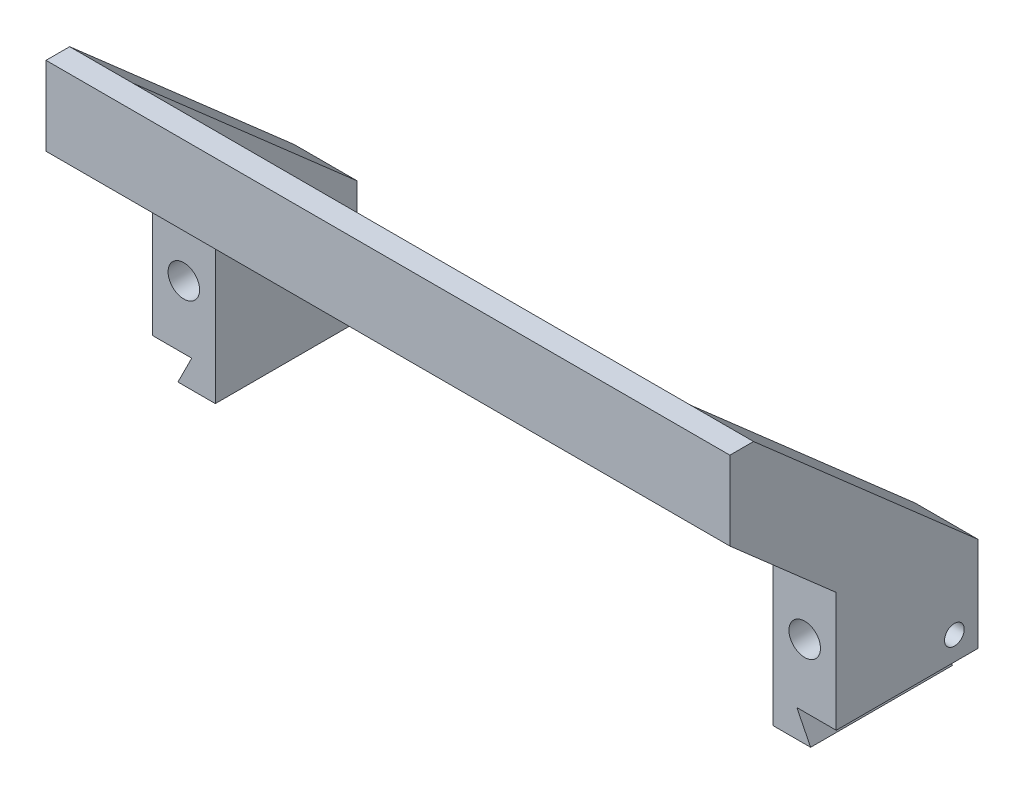
from build123d import *

# Parameters (mm, degrees)
BOSS_EXTRUDE1_DEPTH   = 8
CUT_EXTRUDE2_DEPTH    = 53.318734694
M3X0_5_TAPPED_HOLE1_D = 2.5
SKETCH7_W             = 3
SKETCH7_H             = 10
BOSS_EXTRUDE2_DEPTH   = 4
SKETCH8_W             = 3
SKETCH8_H             = 10
BOSS_EXTRUDE3_DEPTH   = 66.83
SKETCH10_R            = 2
CUT_EXTRUDE3_DEPTH    = 91.659632141
SKETCH11_R            = 2
CUT_EXTRUDE4_DEPTH    = 91.659632141
SKETCH12_W            = 8
SKETCH12_H            = 0.5
CUT_EXTRUDE5_DEPTH    = 95.273108043
SKETCH13_W            = 8
SKETCH13_H            = 0.5
CUT_EXTRUDE6_DEPTH    = 95.273108043


with BuildPart() as part:
    # Sketch1 → Boss-Extrude1 (new body)
    with BuildSketch(Plane(origin=(0, 0, 0), x_dir=(0, 0, -1), z_dir=(1, 0, 0))):
        Polygon((0, 0), (0, 16), (-28.5, 41), (-31.5, 41), (-31.5, 31), (-18, 19.157894737), (-18, 0), align=None)
    boss_extrude1 = extrude(amount=BOSS_EXTRUDE1_DEPTH)

    # Sketch3 → Cut-Extrude2 (cut, through all)
    with BuildSketch(Plane(origin=(0, 0, 0), x_dir=(-1, 0, 0), z_dir=(0, 0, -1))):
        Polygon((-8, 0), (-5, 0), (-3, 4), (-8, 4), align=None)
    cut_extrude2 = extrude(amount=-CUT_EXTRUDE2_DEPTH, mode=Mode.SUBTRACT)

    # M3x0.5 Tapped Hole1 (through all)
    with Locations(Plane(origin=(8, 7, 3), x_dir=(0, 0, 1), z_dir=(1, 0, 0))):
        with Locations((0, 0)):
            m3x0_5_tapped_hole1 = Hole(M3X0_5_TAPPED_HOLE1_D / 2)

    # Sketch7 → Boss-Extrude2 (add)
    with BuildSketch(Plane.ZY):
        with Locations((30, 36)):
            Rectangle(SKETCH7_W, SKETCH7_H)
    extrude(amount=BOSS_EXTRUDE2_DEPTH)

    # Sketch8 → Boss-Extrude3 (add)
    with BuildSketch(Plane.ZY.offset(4)):
        with Locations((30, 36)):
            Rectangle(SKETCH8_W, SKETCH8_H)
    extrude(amount=BOSS_EXTRUDE3_DEPTH)

    # Mirror1: Boss-Extrude1, Cut-Extrude2, M3x0.5 Tapped Hole1 across plane
    add(boss_extrude1.mirror(Plane.ZY.offset(35.415)))
    add(cut_extrude2.mirror(Plane.ZY.offset(35.415)), mode=Mode.SUBTRACT)
    add(m3x0_5_tapped_hole1.mirror(Plane.ZY.offset(35.415)), mode=Mode.SUBTRACT)

    # Sketch10 → Cut-Extrude3 (cut, through all)
    with BuildSketch(Plane.XY.offset(18)):
        with Locations((4, 12)):
            Circle(SKETCH10_R)
    extrude(amount=-CUT_EXTRUDE3_DEPTH, mode=Mode.SUBTRACT)

    # Sketch11 → Cut-Extrude4 (cut, through all)
    with BuildSketch(Plane.XY.offset(18)):
        with Locations((-74.83, 12)):
            Circle(SKETCH11_R)
    extrude(amount=-CUT_EXTRUDE4_DEPTH, mode=Mode.SUBTRACT)

    # Sketch12 → Cut-Extrude5 (cut, through all)
    with BuildSketch(Plane(origin=(0, 0, 0), x_dir=(-1, 0, 0), z_dir=(0, 0, -1))):
        with Locations((-4, 0.25)):
            Rectangle(SKETCH12_W, SKETCH12_H)
    extrude(amount=-CUT_EXTRUDE5_DEPTH, mode=Mode.SUBTRACT)

    # Sketch13 → Cut-Extrude6 (cut, through all)
    with BuildSketch(Plane(origin=(0, 0, 0), x_dir=(-1, 0, 0), z_dir=(0, 0, -1))):
        with Locations((74.83, 0.25)):
            Rectangle(SKETCH13_W, SKETCH13_H)
    extrude(amount=-CUT_EXTRUDE6_DEPTH, mode=Mode.SUBTRACT)


solid = part.part
